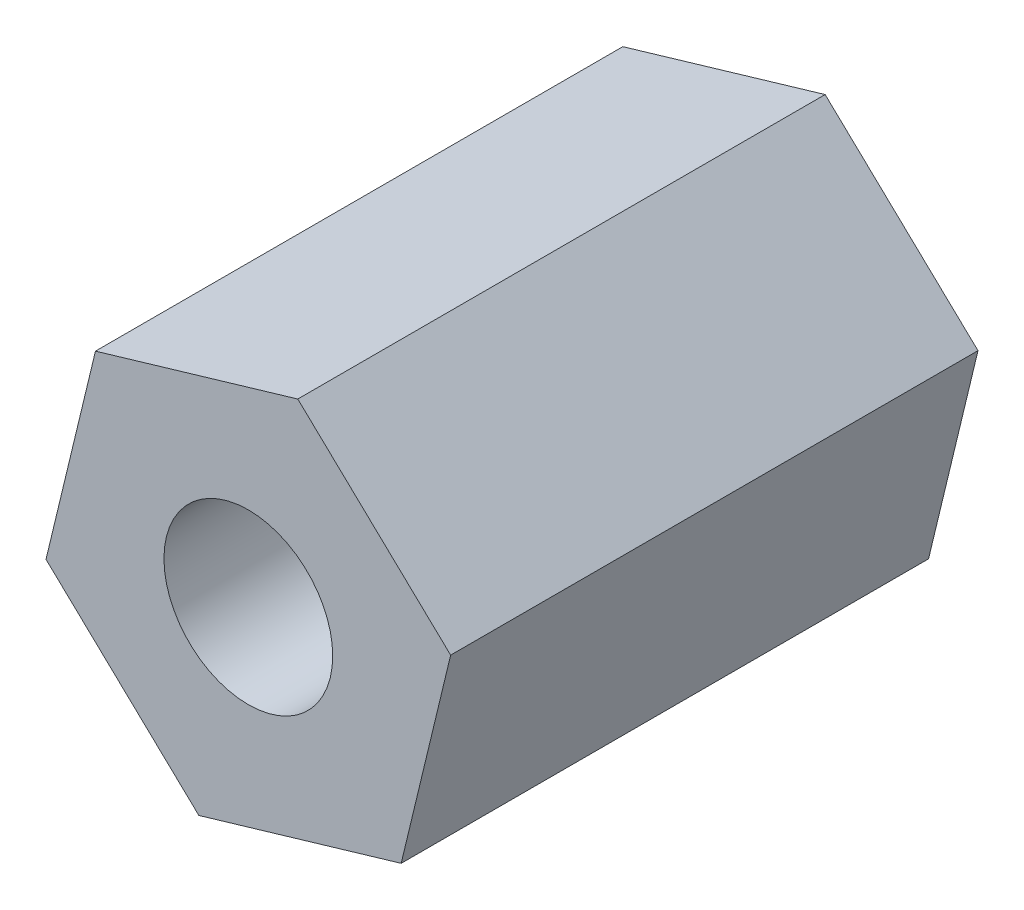
from build123d import *

# Parameters (mm, degrees)
EXTRUDE_1_DEPTH     = 10
SKETCH_2_R          = 1.6
CUT_EXTRUDE_1_DEPTH = 48


with BuildPart() as part:
    # 草图1 → 凸台-拉伸1 (new body)
    with BuildSketch(Plane.XY):
        Polygon((2.898494128, -2.756579727), (3.836515135, 1.131879684), (0.938021007, 3.888459411), (-2.898494128, 2.756579727), (-3.836515135, -1.131879684), (-0.938021007, -3.888459411), align=None)
    extrude(amount=EXTRUDE_1_DEPTH)

    # 草图2 → 切除-拉伸1 (cut)
    with BuildSketch(Plane.XY):
        Circle(SKETCH_2_R)
    extrude(amount=CUT_EXTRUDE_1_DEPTH, mode=Mode.SUBTRACT)


solid = part.part
